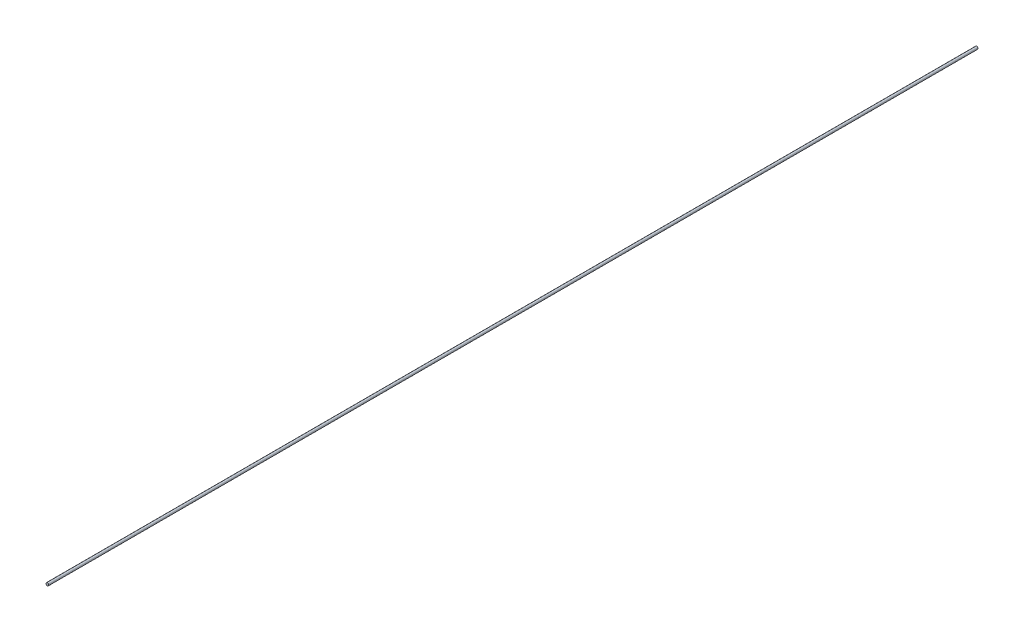
from build123d import *

# Parameters (mm, degrees)
ESQUISSE1_R        = 1
BOSS_EXTRU_1_DEPTH = 700


with BuildPart() as part:
    # Esquisse1 → Boss.-Extru.1 (new body)
    with BuildSketch(Plane.XY):
        Circle(ESQUISSE1_R)
    extrude(amount=BOSS_EXTRU_1_DEPTH)


solid = part.part
